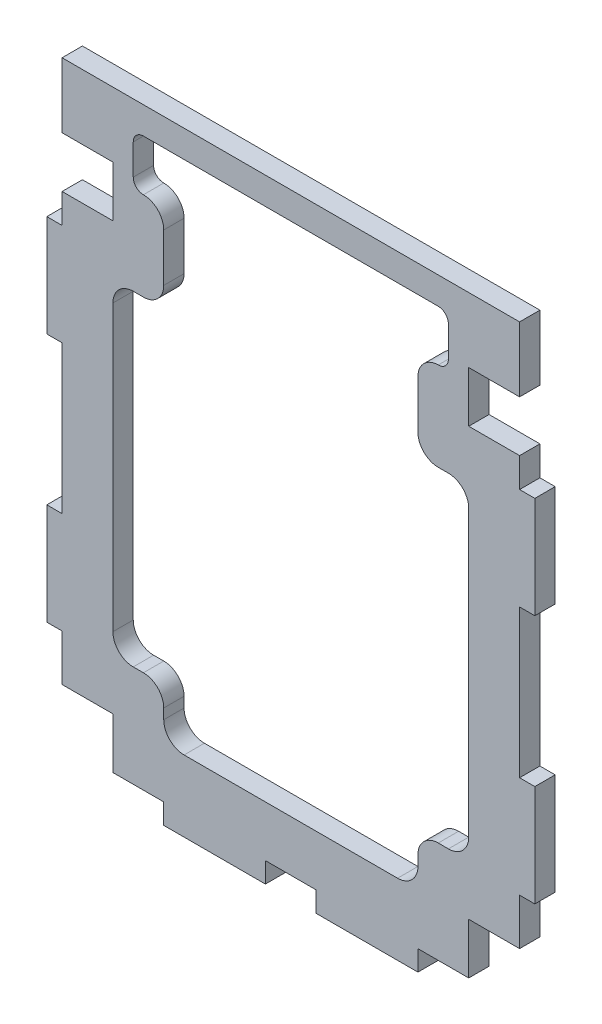
from build123d import *

# Parameters (mm, degrees)
EXTRUDE_1_DEPTH = 2


with BuildPart() as part:
    # Model → 凸台-拉伸1 (new body)
    with BuildSketch(Plane.XY):
        Polygon((973.664956946, 622.02348986), (973.664956946, 615.633131528), (978.664956946, 615.633131528), (978.664956946, 610.633131528), (973.664956946, 610.633131528), (973.664956946, 607.740854359), (972.164956946, 607.740854359), (972.164956946, 597.740854359), (973.664956946, 597.740854359), (973.664956946, 583.190731528), (972.164956946, 583.190731528), (972.164956946, 573.190731528), (973.664956946, 573.190731528), (973.664956946, 568.633131528), (978.664956946, 568.633131528), (978.664956946, 563.633131528), (983.664956946, 563.633131528), (983.664956946, 561.633131528), (993.664956946, 561.633131528), (993.664956946, 563.633131528), (998.664956946, 563.633131528), (998.664956946, 561.633131528), (1008.664956946, 561.633131528), (1008.664956946, 563.633131528), (1013.664956946, 563.633131528), (1013.664956946, 568.633131528), (1018.664956946, 568.633131528), (1018.664956946, 573.190731528), (1020.164956946, 573.190731528), (1020.164956946, 583.190731528), (1018.664956946, 583.190731528), (1018.664956946, 597.740854359), (1020.16592277, 597.740854359), (1020.16592277, 607.740854359), (1018.664956946, 607.740854359), (1018.664956946, 610.633131528), (1013.664956946, 610.633131528), (1013.664956946, 615.633131528), (1018.664956946, 615.633131528), (1018.664956946, 622.02348986), align=None)
        with BuildLine():
            Line((980.664956946, 605.633131528), (981.664956946, 605.633131528))
            ThreePointArc((981.664956946, 605.633131528), (983.079170509, 606.218917965), (983.664956946, 607.633131528))
            Line((983.664956946, 607.633131528), (983.664956946, 612.353131528))
            ThreePointArc((983.664956946, 612.353131528), (983.079170509, 613.76734509), (981.664956946, 614.353131528))
            ThreePointArc((981.664956946, 614.353131528), (980.957850165, 614.646024746), (980.664956946, 615.353131528))
            Line((980.664956946, 615.353131528), (980.664956946, 618.353131528))
            ThreePointArc((980.664956946, 618.353131528), (980.957850165, 619.060238309), (981.664956946, 619.353131528))
            Line((981.664956946, 619.353131528), (1010.664956946, 619.353131528))
            ThreePointArc((1010.664956946, 619.353131528), (1011.372063727, 619.060238309), (1011.664956946, 618.353131528))
            Line((1011.664956946, 618.353131528), (1011.664956946, 615.353131528))
            ThreePointArc((1011.664956946, 615.353131528), (1011.372063727, 614.646024746), (1010.664956946, 614.353131528))
            ThreePointArc((1010.664956946, 614.353131528), (1009.250743384, 613.76734509), (1008.664956946, 612.353131528))
            Line((1008.664956946, 612.353131528), (1008.664956946, 607.633131528))
            ThreePointArc((1008.664956946, 607.633131528), (1009.250743384, 606.218917965), (1010.664956946, 605.633131528))
            Line((1010.664956946, 605.633131528), (1011.664956946, 605.633131528))
            ThreePointArc((1011.664956946, 605.633131528), (1013.079170509, 605.04734509), (1013.664956946, 603.633131528))
            Line((1013.664956946, 603.633131528), (1013.664956946, 575.633131528))
            ThreePointArc((1013.664956946, 575.633131528), (1013.079170509, 574.218917965), (1011.664956946, 573.633131528))
            Line((1011.664956946, 573.633131528), (1010.664956946, 573.633131528))
            ThreePointArc((1010.664956946, 573.633131528), (1009.250743384, 573.04734509), (1008.664956946, 571.633131528))
            Line((1008.664956946, 571.633131528), (1008.664956946, 570.633131528))
            ThreePointArc((1008.664956946, 570.633131528), (1008.079170509, 569.218917965), (1006.664956946, 568.633131528))
            Line((1006.664956946, 568.633131528), (985.664956946, 568.633131528))
            ThreePointArc((985.664956946, 568.633131528), (984.250743384, 569.218917965), (983.664956946, 570.633131528))
            Line((983.664956946, 570.633131528), (983.664956946, 571.633131528))
            ThreePointArc((983.664956946, 571.633131528), (983.079170509, 573.04734509), (981.664956946, 573.633131528))
            Line((981.664956946, 573.633131528), (980.664956946, 573.633131528))
            ThreePointArc((980.664956946, 573.633131528), (979.250743384, 574.218917965), (978.664956946, 575.633131528))
            Line((978.664956946, 575.633131528), (978.664956946, 603.633131528))
            ThreePointArc((978.664956946, 603.633131528), (979.250743384, 605.04734509), (980.664956946, 605.633131528))
        make_face(mode=Mode.SUBTRACT)
    extrude(amount=EXTRUDE_1_DEPTH)


solid = part.part
